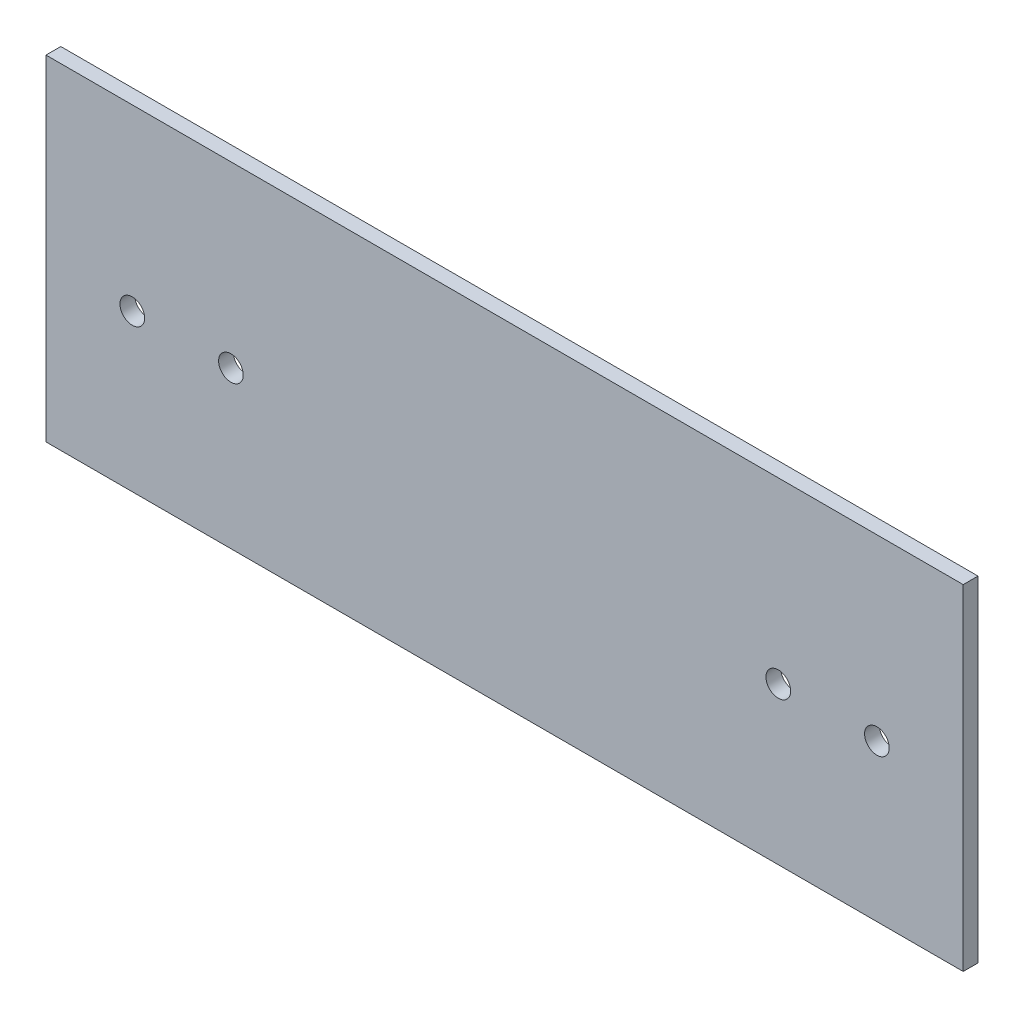
from build123d import *

# Parameters (mm, degrees)
ESQUISSE1_R        = 2.5
BOSS_EXTRU_1_DEPTH = 3


with BuildPart() as part:
    # Esquisse1 → Boss.-Extru.1 (new body)
    with BuildSketch(Plane.XY):
        Polygon((-183, 52.051504798), (-120, 52.051504798), (-60, 52.051504798), (3, 52.051504798), (3, 120), (-183, 120), align=None)
        with Locations((-165.5, 83.79)):
            Circle(ESQUISSE1_R, mode=Mode.SUBTRACT)
        with Locations((-145.5, 83.79)):
            Circle(ESQUISSE1_R, mode=Mode.SUBTRACT)
        with Locations((-34.5, 83.79)):
            Circle(ESQUISSE1_R, mode=Mode.SUBTRACT)
        with Locations((-14.5, 83.79)):
            Circle(ESQUISSE1_R, mode=Mode.SUBTRACT)
    extrude(amount=BOSS_EXTRU_1_DEPTH)


solid = part.part
